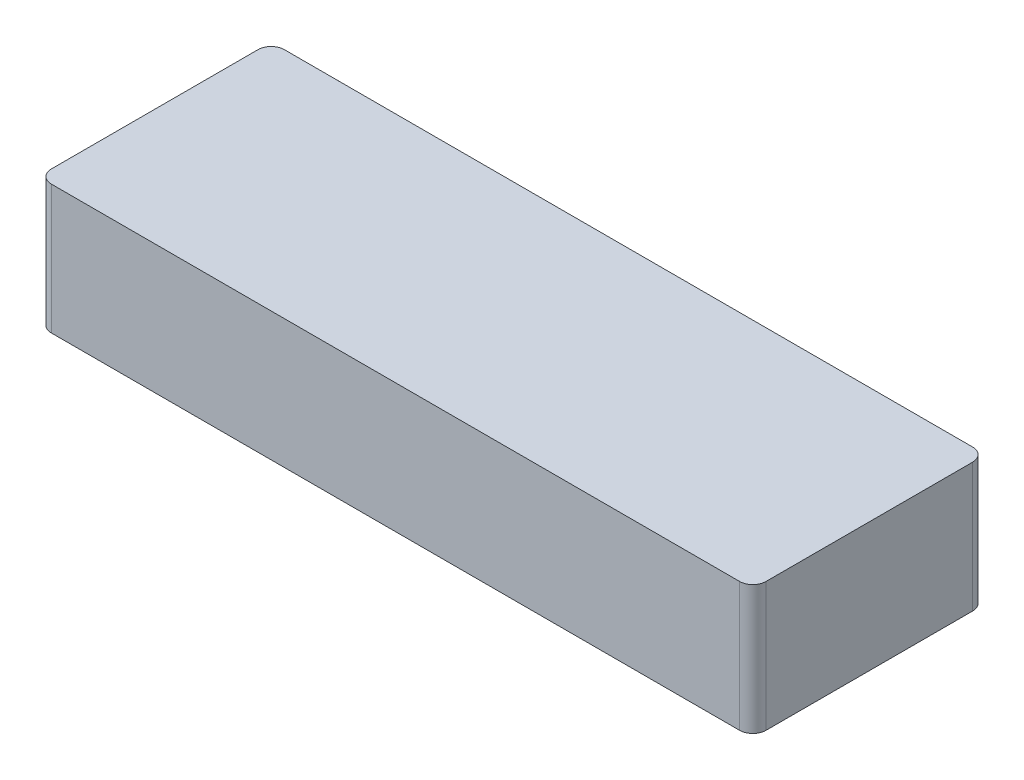
from build123d import *

# Parameters (mm, degrees)
SKETCH1_W           = 137.922
SKETCH1_H           = 44.958
BOSS_EXTRUDE1_DEPTH = 24.892
FILLET1_R           = 2.54


with BuildPart() as part:
    # Sketch1 → Boss-Extrude1 (new body)
    with BuildSketch(Plane(origin=(0, 0, 0), x_dir=(1, 0, 0), z_dir=(0, 1, 0))):
        with Locations((68.961, 22.479)):
            Rectangle(SKETCH1_W, SKETCH1_H)
    extrude(amount=BOSS_EXTRUDE1_DEPTH)

    # Fillet1
    fillet1_edges = [part.edges().sort_by_distance(p)[0] for p in [
        (0, 12.446, -44.958),
        (137.922, 12.446, -44.958),
        (137.922, 12.446, 0),
        (0, 12.446, 0),
    ]]
    fillet(fillet1_edges, radius=FILLET1_R)


solid = part.part
